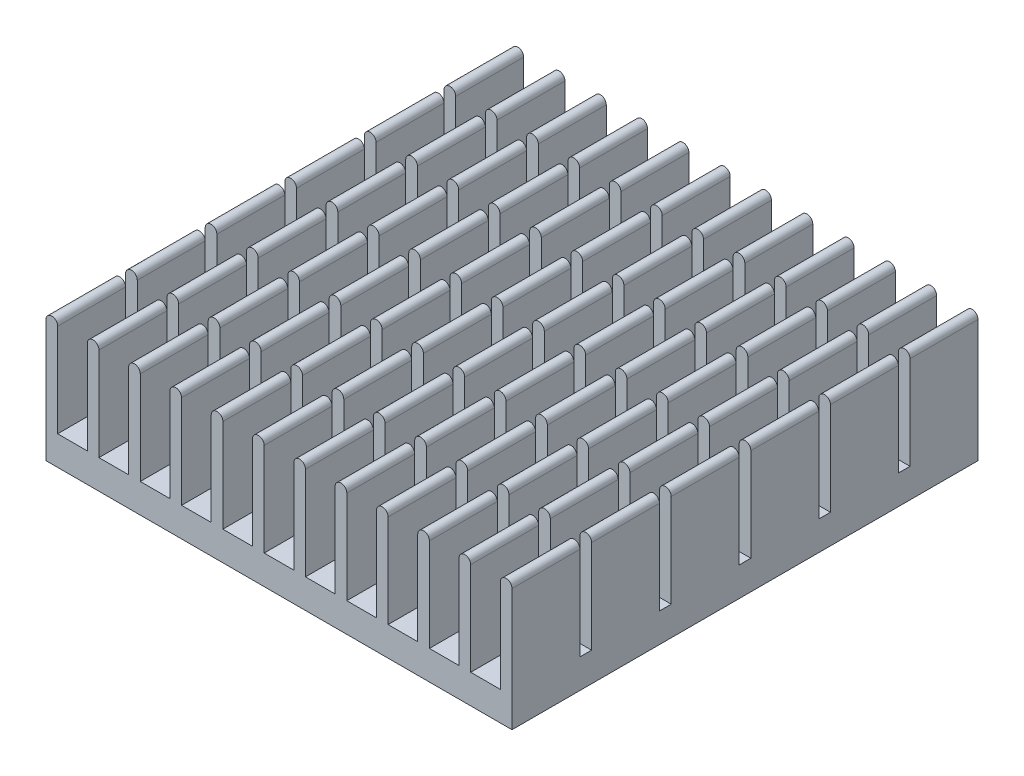
from build123d import *

# Parameters (mm, degrees)
BOSS_EXTRU_1_DEPTH           = 40
ENL_V_MAT_EXTRU_1_DEPTH      = 47.054315759
ENL_V_MAT_EXTRU_1_DEPTH_BACK = 47.054315759
ESQUISSE4_W                  = 1
ESQUISSE4_H                  = 8.5


with BuildPart() as part:
    # Esquisse1 → Boss.-Extru.1 (new body)
    with BuildSketch(Plane.XY):
        with BuildLine():
            Line((-16.454545455, 2.5), (-19, 2.5))
            Line((-19, 2.5), (-19, 10.5))
            ThreePointArc((-19, 10.5), (-19.5, 11), (-20, 10.5))
            Line((-20, 10.5), (-20, 2.5))
            Line((-20, 2.5), (-20, 0))
            Line((-20, 0), (20, 0))
            Line((20, 0), (20, 2.5))
            Line((20, 2.5), (20, 10.5))
            ThreePointArc((20, 10.5), (19.853553391, 10.853553391), (19.5, 11))
            ThreePointArc((19.5, 11), (19.146446609, 10.853553391), (19, 10.5))
            Line((19, 10.5), (19, 2.5))
            Line((19, 2.5), (16.454545455, 2.5))
            Line((16.454545455, 2.5), (16.454545455, 10.5))
            ThreePointArc((16.454545455, 10.5), (15.954545455, 11), (15.454545455, 10.5))
            Line((15.454545455, 10.5), (15.454545455, 2.5))
            Line((15.454545455, 2.5), (12.909090909, 2.5))
            Line((12.909090909, 2.5), (12.909090909, 10.5))
            ThreePointArc((12.909090909, 10.5), (12.409090909, 11), (11.909090909, 10.5))
            Line((11.909090909, 10.5), (11.909090909, 2.5))
            Line((11.909090909, 2.5), (9.363636364, 2.5))
            Line((9.363636364, 2.5), (9.363636364, 10.5))
            ThreePointArc((9.363636364, 10.5), (8.863636364, 11), (8.363636364, 10.5))
            Line((8.363636364, 10.5), (8.363636364, 2.5))
            Line((8.363636364, 2.5), (5.818181818, 2.5))
            Line((5.818181818, 2.5), (5.818181818, 10.5))
            ThreePointArc((5.818181818, 10.5), (5.318181818, 11), (4.818181818, 10.5))
            Line((4.818181818, 10.5), (4.818181818, 2.5))
            Line((4.818181818, 2.5), (2.272727273, 2.5))
            Line((2.272727273, 2.5), (2.272727273, 10.5))
            ThreePointArc((2.272727273, 10.5), (1.772727273, 11), (1.272727273, 10.5))
            Line((1.272727273, 10.5), (1.272727273, 2.5))
            Line((1.272727273, 2.5), (-1.272727273, 2.5))
            Line((-1.272727273, 2.5), (-1.272727273, 10.5))
            ThreePointArc((-1.272727273, 10.5), (-1.772727273, 11), (-2.272727273, 10.5))
            Line((-2.272727273, 10.5), (-2.272727273, 2.5))
            Line((-2.272727273, 2.5), (-4.818181818, 2.5))
            Line((-4.818181818, 2.5), (-4.818181818, 10.5))
            ThreePointArc((-4.818181818, 10.5), (-5.318181818, 11), (-5.818181818, 10.5))
            Line((-5.818181818, 10.5), (-5.818181818, 2.5))
            Line((-5.818181818, 2.5), (-8.363636364, 2.5))
            Line((-8.363636364, 2.5), (-8.363636364, 10.5))
            ThreePointArc((-8.363636364, 10.5), (-8.863636364, 11), (-9.363636364, 10.5))
            Line((-9.363636364, 10.5), (-9.363636364, 2.5))
            Line((-9.363636364, 2.5), (-11.909090909, 2.5))
            Line((-11.909090909, 2.5), (-11.909090909, 10.5))
            ThreePointArc((-11.909090909, 10.5), (-12.409090909, 11), (-12.909090909, 10.5))
            Line((-12.909090909, 10.5), (-12.909090909, 2.5))
            Line((-12.909090909, 2.5), (-15.454545455, 2.5))
            Line((-15.454545455, 2.5), (-15.454545455, 10.5))
            ThreePointArc((-15.454545455, 10.5), (-15.954545455, 11), (-16.454545455, 10.5))
            Line((-16.454545455, 10.5), (-16.454545455, 2.5))
        make_face()
    extrude(amount=BOSS_EXTRU_1_DEPTH)

    # Esquisse4 → Enlèv. mat.-Extru.1 (cut, two sides: drawn at the far end of the back side and taken through both)
    with BuildSketch(Plane(origin=(0, 0, 0), x_dir=(0, 0, -1), z_dir=(1, 0, 0)).offset(-ENL_V_MAT_EXTRU_1_DEPTH_BACK)):
        with Locations((-26.833333333, 6.75)):
            Rectangle(ESQUISSE4_W, ESQUISSE4_H)
        with Locations((-33.666666667, 6.75)):
            Rectangle(ESQUISSE4_W, ESQUISSE4_H)
        with Locations((-20, 6.75)):
            Rectangle(ESQUISSE4_W, ESQUISSE4_H)
        with Locations((-13.166666667, 6.75)):
            Rectangle(ESQUISSE4_W, ESQUISSE4_H)
        with Locations((-6.333333333, 6.75)):
            Rectangle(ESQUISSE4_W, ESQUISSE4_H)
    extrude(amount=ENL_V_MAT_EXTRU_1_DEPTH + ENL_V_MAT_EXTRU_1_DEPTH_BACK, mode=Mode.SUBTRACT)


solid = part.part
